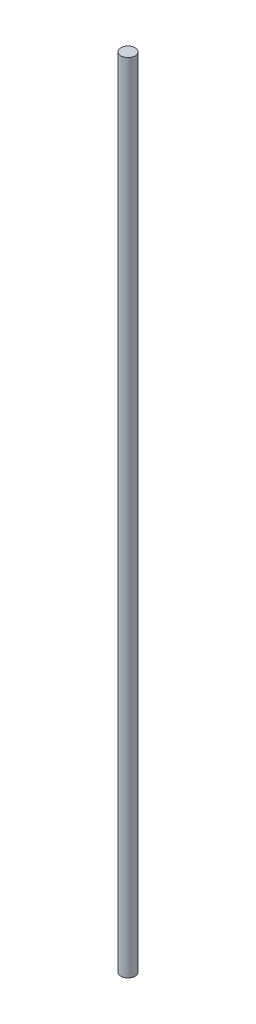
from build123d import *

# Parameters (mm, degrees)
SKETCH1_R           = 2
BOSS_EXTRUDE1_DEPTH = 225


with BuildPart() as part:
    # Sketch1 → Boss-Extrude1 (new body)
    with BuildSketch(Plane(origin=(0, 0, 0), x_dir=(1, 0, 0), z_dir=(0, 1, 0))):
        with Locations(Location((-20.440122927, 20.57602509, 0), (0, 0, 270))):
            Circle(SKETCH1_R)
    extrude(amount=BOSS_EXTRUDE1_DEPTH)


solid = part.part
